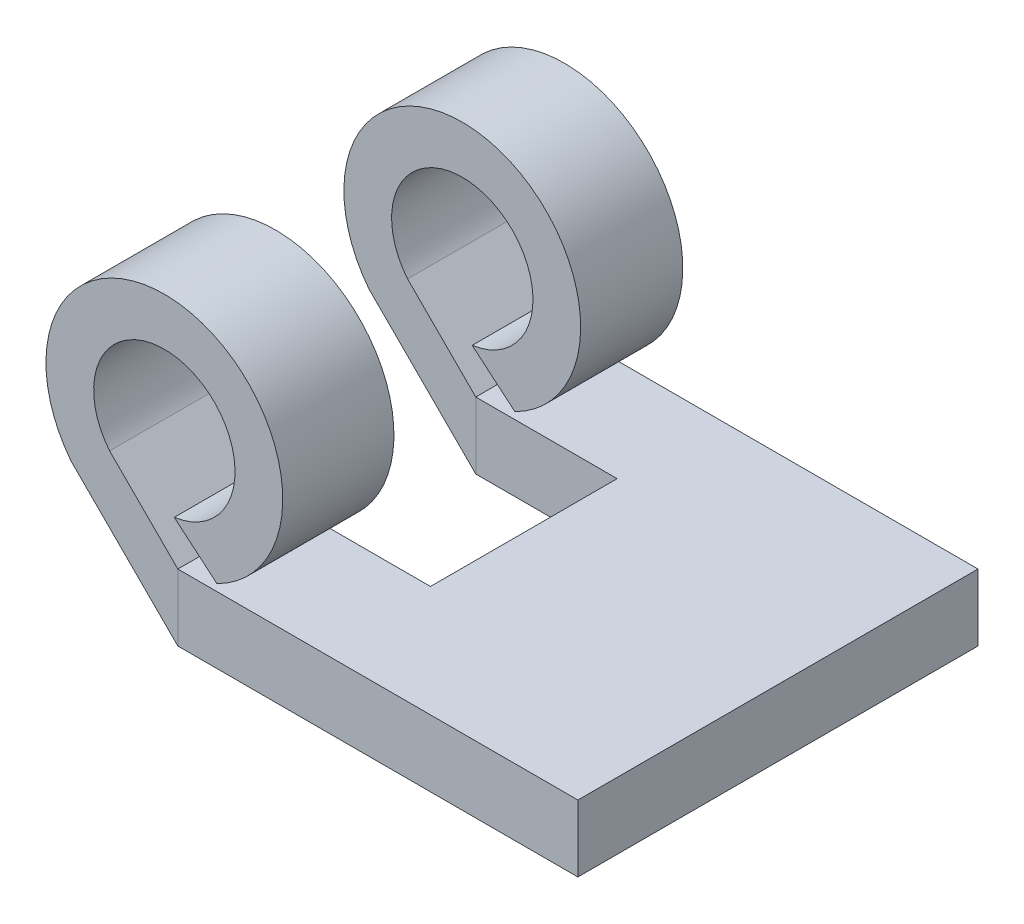
from build123d import *

# Parameters (mm, degrees)
SKETCH1_W           = 19.05
SKETCH1_H           = 3.175
BOSS_EXTRUDE1_DEPTH = 19.05
BOSS_EXTRUDE2_DEPTH = 19.05
SKETCH3_W           = 14.499116916
SKETCH3_H           = 8.89
CUT_EXTRUDE1_DEPTH  = 19.05


with BuildPart() as part:
    # Sketch1 → Boss-Extrude1 (new body)
    with BuildSketch(Plane.XY):
        with Locations((9.525, 1.5875)):
            Rectangle(SKETCH1_W, SKETCH1_H)
    extrude(amount=BOSS_EXTRUDE1_DEPTH)


with BuildPart() as body_2:
    # Sketch2 → Boss-Extrude2 (new body)
    with BuildSketch(Plane.XY.offset(19.05)):
        with BuildLine():
            Line((0, 3.175), (-3.246475658, 6.421475658))
            ThreePointArc((-3.246475658, 6.421475658), (0.581460119, 11.688175821), (-0.169373011, 5.220759604))
            Line((-0.169373011, 5.220759604), (1.861944145, 3.503263964))
            ThreePointArc((1.861944145, 3.503263964), (0.609751023, 14.048523374), (-5.085681873, 5.085681873))
            Line((-5.085681873, 5.085681873), (0, 0))
            Line((0, 0), (0, 3.175))
        make_face()
    extrude(amount=-BOSS_EXTRUDE2_DEPTH)


with BuildPart() as cut_extrude1_tool:
    # Sketch3 → Cut-Extrude1 (new body)
    with BuildSketch(Plane.XZ):
        with Locations((-0.516235889, 9.3091)):
            Rectangle(SKETCH3_W, SKETCH3_H)
    extrude(amount=-CUT_EXTRUDE1_DEPTH)


with BuildPart() as part_1:
    add(part.part)

    # Cut-Extrude1: cut by cut_extrude1_tool
    add(cut_extrude1_tool.part, mode=Mode.SUBTRACT)


with BuildPart() as body_2_1:
    add(body_2.part)

    # Cut-Extrude1: cut by cut_extrude1_tool
    add(cut_extrude1_tool.part, mode=Mode.SUBTRACT)


solid = Compound([part_1.part, body_2_1.part])
